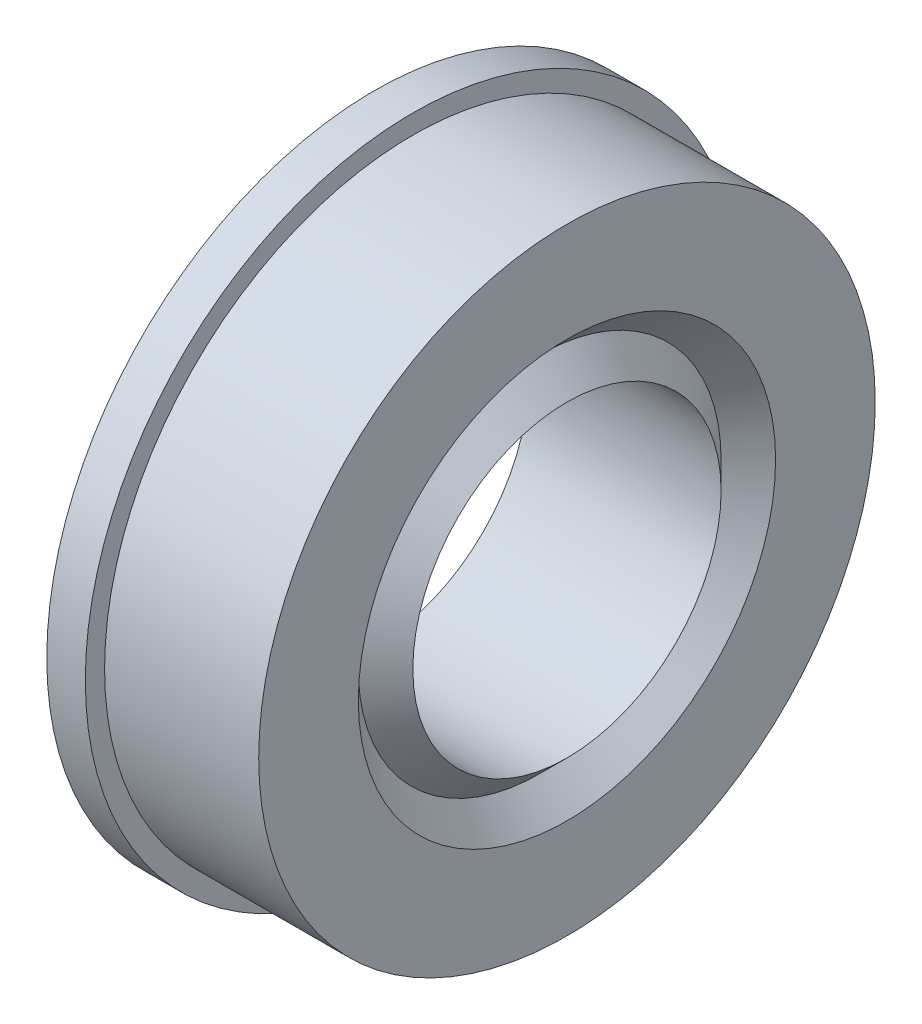
from build123d import *

# Parameters (mm, degrees)
SKETCH_2_R      = 8.5
SKETCH_2_R_2    = 8
EXTRUDE_1_DEPTH = 1


with BuildPart() as part:
    # 草图1 → 旋转1 (revolve)
    with BuildSketch(Plane(origin=(0, 0, 0), x_dir=(1, 0, 0), z_dir=(0, 1, 0)), mode=Mode.PRIVATE) as revolve_1_sk:
        Polygon((0, -4), (-5, -4), (-4.292893219, -4.707106781), (-5, -5.414213562), (-5, -6.585786438), (-4.292893219, -7.292893219), (-5, -8), (0, -8), (0, -5.414213562), (-0.707106781, -4.707106781), align=None)
    revolve(revolve_1_sk.sketch.rotate(Axis((0, 0, 0), (-1, 0, 0)), 180), axis=Axis((0, 0, 0), (-1, 0, 0)))


with BuildPart() as body_2:
    # 草图2 → 凸台-拉伸1 (new body)
    with BuildSketch(Plane.ZY.offset(5)):
        Circle(SKETCH_2_R)
        Circle(SKETCH_2_R_2, mode=Mode.SUBTRACT)
    extrude(amount=-EXTRUDE_1_DEPTH)


solid = Compound([part.part, body_2.part])
